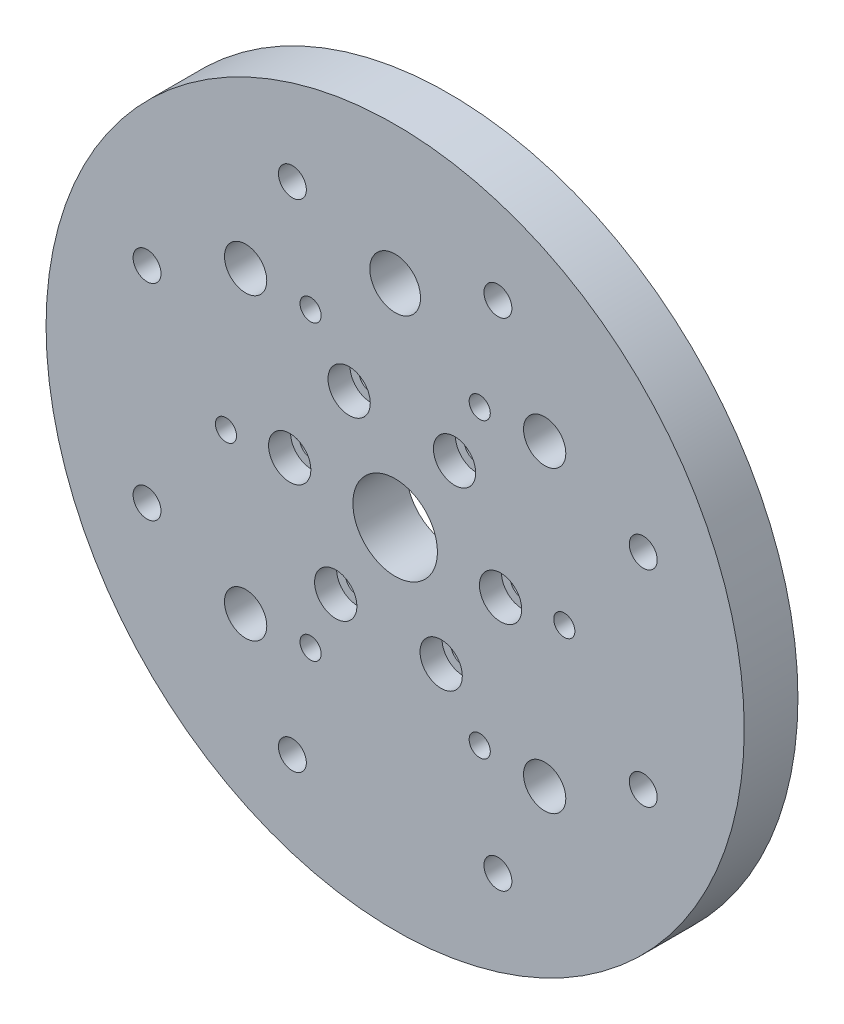
from build123d import *

# Parameters (mm, degrees)
BRIDA_D3_25IN_1_4IN_START          = 413.9
CROQUIS1_R                         = 41.275
BRIDA_D3_25IN_1_4IN_DEPTH          = 6.35
BARRENOS_SALIDA_M6_START           = 413.9
CROQUIS2_R                         = 1.45
CROQUIS2_R_2                       = 5
BARRENOS_SALIDA_M6_DEPTH           = 6.35
REFRENTADO_M2_5_START              = 417.65
CROQUIS3_R                         = 2.5
REFRENTADO_M2_5_DEPTH              = 2.6
ISO9409_50_4XM6_Y_PASADOR_D6_START = 413.9
CROQUIS4_R                         = 2.5
CROQUIS4_R_2                       = 3
ISO9409_50_4XM6_Y_PASADOR_D6_DEPTH = 6.35
PATRON_8XM4_PCD2_5IN_START         = 413.9
CROQUIS5_R                         = 1.65
PATRON_8XM4_PCD2_5IN_DEPTH         = 6.35
PATRON_6XM3_PCD40_START            = 413.9
CROQUIS6_R                         = 1.25
PATRON_6XM3_PCD40_DEPTH            = 6.35


with BuildPart() as part:
    # Croquis1 → Brida_D3-25in_1-4in (new body)
    with BuildSketch(Plane.XY.offset(BRIDA_D3_25IN_1_4IN_START)):
        with Locations((152.4, 0)):
            Circle(CROQUIS1_R)
    extrude(amount=BRIDA_D3_25IN_1_4IN_DEPTH)

    # Croquis2 → Barrenos_salida_M6 (cut)
    with BuildSketch(Plane.XY.offset(BARRENOS_SALIDA_M6_START)):
        with Locations((159.426042223, 10.338507178)):
            Circle(CROQUIS2_R)
        with Locations((146.959611258, 11.253984643)):
            Circle(CROQUIS2_R)
        with Locations((139.933569035, 0.915477464)):
            Circle(CROQUIS2_R)
        with Locations((145.373957777, -10.338507178)):
            Circle(CROQUIS2_R)
        with Locations((157.840388742, -11.253984643)):
            Circle(CROQUIS2_R)
        with Locations((164.866430965, -0.915477464)):
            Circle(CROQUIS2_R)
        with Locations((152.4, 0)):
            Circle(CROQUIS2_R_2)
    extrude(amount=BARRENOS_SALIDA_M6_DEPTH, mode=Mode.SUBTRACT)

    # Croquis3 → Refrentado_M2-5 (cut)
    with BuildSketch(Plane.XY.offset(REFRENTADO_M2_5_START)):
        with Locations((159.426042223, 10.338507178)):
            Circle(CROQUIS3_R)
        with Locations((146.959611258, 11.253984643)):
            Circle(CROQUIS3_R)
        with Locations((139.933569035, 0.915477464)):
            Circle(CROQUIS3_R)
        with Locations((145.373957777, -10.338507178)):
            Circle(CROQUIS3_R)
        with Locations((157.840388742, -11.253984643)):
            Circle(CROQUIS3_R)
        with Locations((164.866430965, -0.915477464)):
            Circle(CROQUIS3_R)
    extrude(amount=REFRENTADO_M2_5_DEPTH, mode=Mode.SUBTRACT)

    # Croquis4 → ISO9409-50_4xM6_y_pasador_D6 (cut)
    with BuildSketch(Plane.XY.offset(ISO9409_50_4XM6_Y_PASADOR_D6_START)):
        with Locations((170.07766953, 17.67766953)):
            Circle(CROQUIS4_R)
        with Locations((134.72233047, 17.67766953)):
            Circle(CROQUIS4_R)
        with Locations((134.72233047, -17.67766953)):
            Circle(CROQUIS4_R)
        with Locations((170.07766953, -17.67766953)):
            Circle(CROQUIS4_R)
        with Locations((152.4, 25)):
            Circle(CROQUIS4_R_2)
    extrude(amount=ISO9409_50_4XM6_Y_PASADOR_D6_DEPTH, mode=Mode.SUBTRACT)

    # Croquis5 → Patron_8xM4_PCD2-5in (cut)
    with BuildSketch(Plane.XY.offset(PATRON_8XM4_PCD2_5IN_START)):
        with Locations((181.733175157, 12.150198978)):
            Circle(CROQUIS5_R)
        with Locations((164.550198978, 29.333175157)):
            Circle(CROQUIS5_R)
        with Locations((140.249801022, 29.333175157)):
            Circle(CROQUIS5_R)
        with Locations((123.066824843, 12.150198978)):
            Circle(CROQUIS5_R)
        with Locations((123.066824843, -12.150198978)):
            Circle(CROQUIS5_R)
        with Locations((140.249801022, -29.333175157)):
            Circle(CROQUIS5_R)
        with Locations((164.550198978, -29.333175157)):
            Circle(CROQUIS5_R)
        with Locations((181.733175157, -12.150198978)):
            Circle(CROQUIS5_R)
    extrude(amount=PATRON_8XM4_PCD2_5IN_DEPTH, mode=Mode.SUBTRACT)

    # Croquis6 → Patron_6xM3_PCD40 (cut)
    with BuildSketch(Plane.XY.offset(PATRON_6XM3_PCD40_START)):
        with Locations((172.4, 0)):
            Circle(CROQUIS6_R)
        with Locations((162.4, 17.320508076)):
            Circle(CROQUIS6_R)
        with Locations((142.4, 17.320508076)):
            Circle(CROQUIS6_R)
        with Locations((132.4, 0)):
            Circle(CROQUIS6_R)
        with Locations((142.4, -17.320508076)):
            Circle(CROQUIS6_R)
        with Locations((162.4, -17.320508076)):
            Circle(CROQUIS6_R)
    extrude(amount=PATRON_6XM3_PCD40_DEPTH, mode=Mode.SUBTRACT)


solid = part.part
